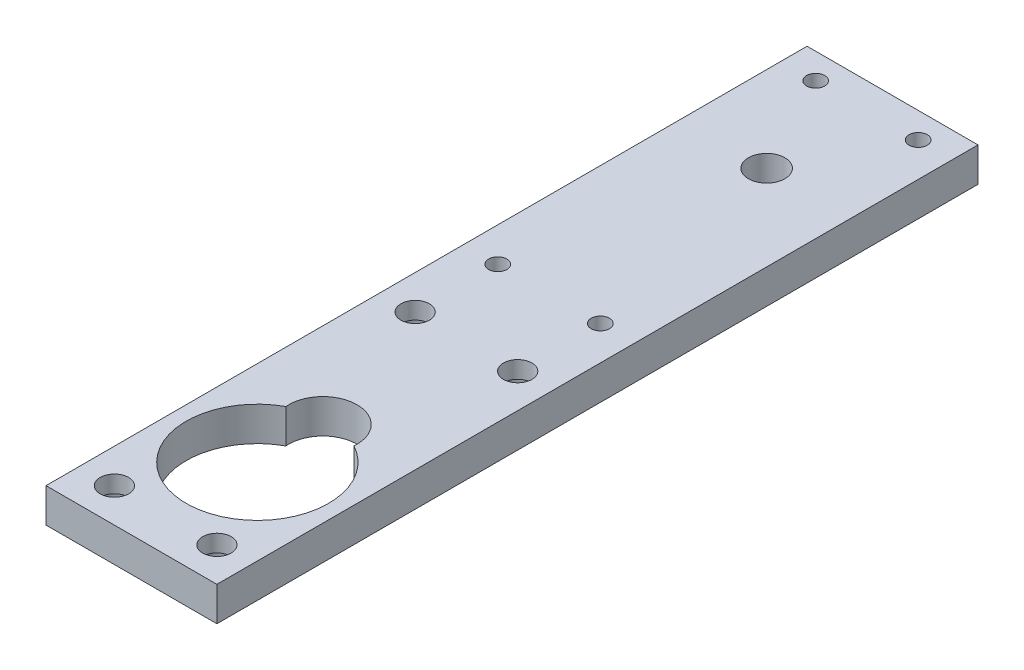
from build123d import *

# Parameters (mm, degrees)
SKETCH_1_W          = 15
SKETCH_1_H          = 66.8
SKETCH_1_R          = 1.6
SKETCH_1_R_2        = 0.8
SKETCH_1_R_3        = 1.25
EXTRUDE_1_DEPTH     = 3
SKETCH_1_5_R        = 2
SKETCH_1_5_R_2      = 1.3
CUT_EXTRUDE_3_DEPTH = 1.5


with BuildPart() as part:
    # 草图1 → 凸台-拉伸1 (new body)
    with BuildSketch(Plane(origin=(0, 0, 0), x_dir=(1, 0, 0), z_dir=(0, 1, 0))):
        with Locations((7.5, 1)):
            Rectangle(SKETCH_1_W, SKETCH_1_H)
        with Locations((7.5, 23.35)):
            Circle(SKETCH_1_R, mode=Mode.SUBTRACT)
        with BuildLine():
            ThreePointArc((10.488636323, -15.860869565), (7.5, -27.6), (4.511363677, -15.860869565))
            ThreePointArc((4.511363677, -15.860869565), (7.5, -12.6), (10.488636323, -15.860869565))
        make_face(mode=Mode.SUBTRACT)
        with Locations((12, 32.15)):
            Circle(SKETCH_1_R_2, mode=Mode.SUBTRACT)
        with Locations((3, 4.25)):
            Circle(SKETCH_1_R_2, mode=Mode.SUBTRACT)
        with Locations((3, 32.15)):
            Circle(SKETCH_1_R_2, mode=Mode.SUBTRACT)
        with Locations((12, 4.25)):
            Circle(SKETCH_1_R_2, mode=Mode.SUBTRACT)
        with Locations((12, -3)):
            Circle(SKETCH_1_R_3, mode=Mode.SUBTRACT)
        with Locations((3, -29.4)):
            Circle(SKETCH_1_R_3, mode=Mode.SUBTRACT)
        with Locations((3, -3)):
            Circle(SKETCH_1_R_3, mode=Mode.SUBTRACT)
        with Locations((12, -29.4)):
            Circle(SKETCH_1_R_3, mode=Mode.SUBTRACT)
    extrude(amount=EXTRUDE_1_DEPTH)

    # 草图1<5> → 切除-拉伸3 (cut)
    with BuildSketch(Plane(origin=(0, 0, 0), x_dir=(1, 0, 0), z_dir=(0, 1, 0))):
        with Locations((3, -3)):
            Circle(SKETCH_1_5_R)
        with Locations((12, -3)):
            Circle(SKETCH_1_5_R)
        with Locations((3, -29.4)):
            Circle(SKETCH_1_5_R)
        with Locations((12, -29.4)):
            Circle(SKETCH_1_5_R)
        with Locations((3, 4.25)):
            Circle(SKETCH_1_5_R_2)
        with Locations((12, 4.25)):
            Circle(SKETCH_1_5_R_2)
        with Locations((3, 32.15)):
            Circle(SKETCH_1_5_R_2)
        with Locations((12, 32.15)):
            Circle(SKETCH_1_5_R_2)
    extrude(amount=CUT_EXTRUDE_3_DEPTH, mode=Mode.SUBTRACT)


solid = part.part
